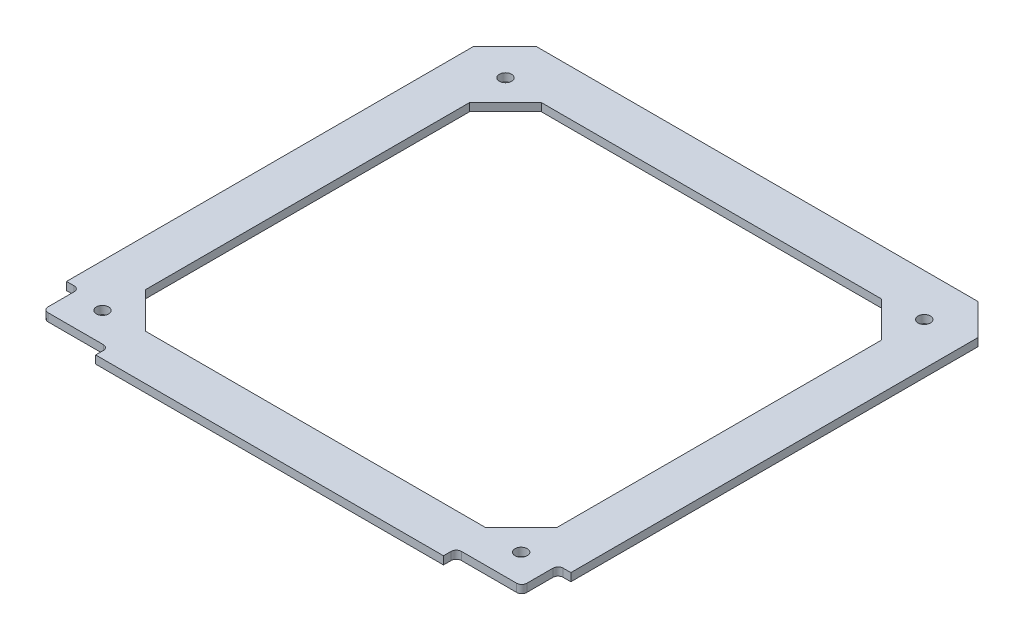
from build123d import *

# Parameters (mm, degrees)
BOSS_EXTRUDE1_DEPTH      = 1.56
CUT_EXTRUDE1_DEPTH       = 1.56
M2_CLEARANCE_HOLE1_D     = 2.4
M2_CLEARANCE_HOLE1_DEPTH = 38.1
M2_CLEARANCE_HOLE1_TIP   = 0.721032743


with BuildPart() as part:
    # Sketch1 → Boss-Extrude1 (new body)
    with BuildSketch(Plane(origin=(0, 0, 0), x_dir=(1, 0, 0), z_dir=(0, 1, 0))):
        with BuildLine():
            Line((-49.356685196, 41.604788024), (-43.256685196, 47.704788024))
            Line((-43.256685196, 47.704788024), (43.143314804, 47.704788024))
            Line((43.143314804, 47.704788024), (49.243314804, 41.604788024))
            Line((49.243314804, 41.604788024), (49.243314804, -37.995211976))
            Line((49.243314804, -37.995211976), (47.743314804, -37.995211976))
            ThreePointArc((47.743314804, -37.995211976), (47.036208023, -38.288105194), (46.743314804, -38.995211976))
            Line((46.743314804, -38.995211976), (46.743314804, -44.095211976))
            ThreePointArc((46.743314804, -44.095211976), (46.450421585, -44.802318757), (45.743314804, -45.095211976))
            Line((45.743314804, -45.095211976), (34.943314804, -45.095211976))
            ThreePointArc((34.943314804, -45.095211976), (34.236208023, -45.388105194), (33.943314804, -46.095211976))
            Line((33.943314804, -46.095211976), (33.943314804, -47.595211976))
            Line((33.943314804, -47.595211976), (-34.056685196, -47.595211976))
            Line((-34.056685196, -47.595211976), (-34.056685196, -46.095211976))
            ThreePointArc((-34.056685196, -46.095211976), (-34.349578415, -45.388105194), (-35.056685196, -45.095211976))
            Line((-35.056685196, -45.095211976), (-45.856685196, -45.095211976))
            ThreePointArc((-45.856685196, -45.095211976), (-46.563791977, -44.802318757), (-46.856685196, -44.095211976))
            Line((-46.856685196, -44.095211976), (-46.856685196, -38.995211976))
            ThreePointArc((-46.856685196, -38.995211976), (-47.149578415, -38.288105194), (-47.856685196, -37.995211976))
            Line((-47.856685196, -37.995211976), (-49.356685196, -37.995211976))
            Line((-49.356685196, -37.995211976), (-49.356685196, 41.604788024))
        make_face()
    extrude(amount=BOSS_EXTRUDE1_DEPTH)

    # Sketch2 → Cut-Extrude1 (cut)
    with BuildSketch(Plane(origin=(0, 1.56, 0), x_dir=(1, 0, 0), z_dir=(0, 1, 0))):
        Polygon((-40.243314804, 31.704788024), (-33.243314804, 38.704788024), (33.243314804, 38.704788024), (40.243314804, 31.704788024), (40.243314804, -31.704788024), (33.243314804, -38.704788024), (-33.243314804, -38.704788024), (-40.243314804, -31.704788024), align=None)
    extrude(amount=-CUT_EXTRUDE1_DEPTH, mode=Mode.SUBTRACT)

    # M2 Clearance Hole1
    with Locations(Plane(origin=(0, 1.56, 0), x_dir=(1, 0, 0), z_dir=(0, 1, 0))):
        with Locations((40.929491149, 39.39737116), (40.929491149, -39.39737116), (-40.929491149, -39.39737116), (-40.929491149, 39.39737116), (0, 0)):
            Hole(M2_CLEARANCE_HOLE1_D / 2, depth=M2_CLEARANCE_HOLE1_DEPTH)
            with Locations((0, 0, -(M2_CLEARANCE_HOLE1_DEPTH + M2_CLEARANCE_HOLE1_TIP / 2))):  # 118° drill point
                Cone(0, M2_CLEARANCE_HOLE1_D / 2, M2_CLEARANCE_HOLE1_TIP, mode=Mode.SUBTRACT)


solid = part.part
